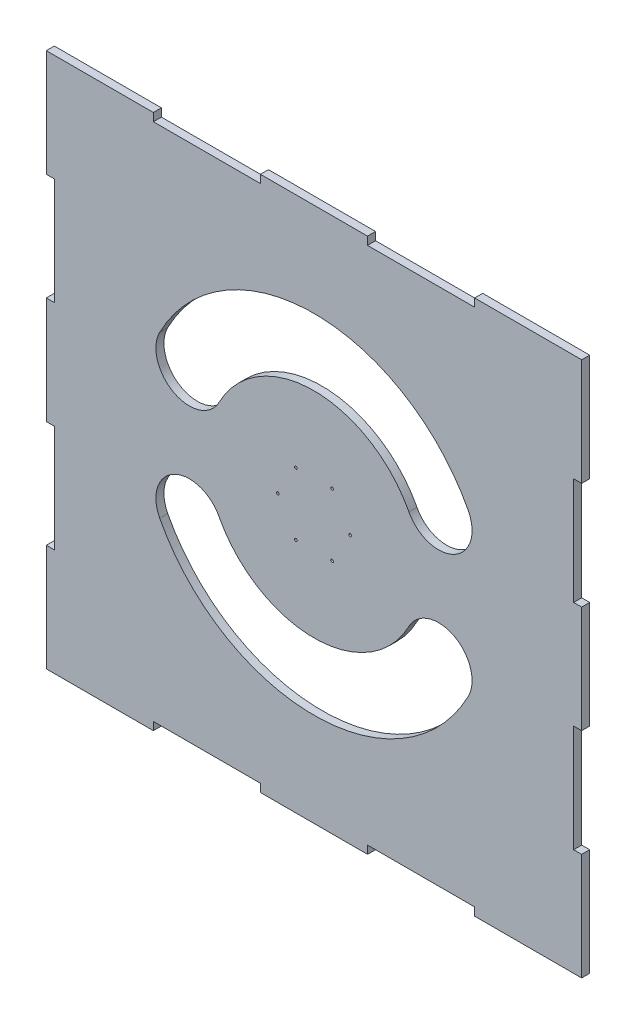
from build123d import *

# Parameters (mm, degrees)
BOSS_EXTRUDE1_DEPTH = 3
SKETCH2_R           = 0.5
CUT_EXTRUDE1_DEPTH  = 3


with BuildPart() as part:
    # Sketch1 → Boss-Extrude1 (new body)
    with BuildSketch(Plane.XY):
        Polygon((100, -60), (100, -100), (60, -100), (60, -97), (20, -97), (20, -100), (-20, -100), (-20, -97), (-60, -97), (-60, -100), (-100, -100), (-100, -60), (-97, -60), (-97, -20), (-100, -20), (-100, 20), (-97, 20), (-97, 60), (-100, 60), (-100, 100), (-60, 100), (-60, 97), (-20, 97), (-20, 100), (20, 100), (20, 97), (60, 97), (60, 100), (100, 100), (100, 60), (97, 60), (97, 20), (100, 20), (100, -20), (97, -20), (97, -60), align=None)
        with BuildLine():
            ThreePointArc((-57.630385488, -30.062246565), (0, -65), (57.630385488, -30.062246565))
            ThreePointArc((57.630385488, -30.062246565), (52.32882031, -13.198278863), (35.464852608, -18.49984404))
            ThreePointArc((35.464852608, -18.49984404), (0, -40), (-35.464852608, -18.49984404))
            ThreePointArc((-35.464852608, -18.49984404), (-52.32882031, -13.198278863), (-57.630385488, -30.062246565))
        make_face(mode=Mode.SUBTRACT)
        with BuildLine():
            ThreePointArc((35.464852608, 18.49984404), (0, 40), (-35.464852608, 18.49984404))
            ThreePointArc((-35.464852608, 18.49984404), (-52.32882031, 13.198278863), (-57.630385488, 30.062246565))
            ThreePointArc((-57.630385488, 30.062246565), (0, 65), (57.630385488, 30.062246565))
            ThreePointArc((57.630385488, 30.062246565), (52.32882031, 13.198278863), (35.464852608, 18.49984404))
        make_face(mode=Mode.SUBTRACT)
    extrude(amount=BOSS_EXTRUDE1_DEPTH)

    # Sketch2 → Cut-Extrude1 (cut)
    with BuildSketch(Plane.XY.offset(3)):
        with Locations((-13.5, 0)):
            Circle(SKETCH2_R)
        with Locations((-6.75, 11.691342951)):
            Circle(SKETCH2_R)
        with Locations((6.75, 11.691342951)):
            Circle(SKETCH2_R)
        with Locations((13.5, 0)):
            Circle(SKETCH2_R)
        with Locations((6.75, -11.691342951)):
            Circle(SKETCH2_R)
        with Locations((-6.75, -11.691342951)):
            Circle(SKETCH2_R)
    extrude(amount=-CUT_EXTRUDE1_DEPTH, mode=Mode.SUBTRACT)


solid = part.part
